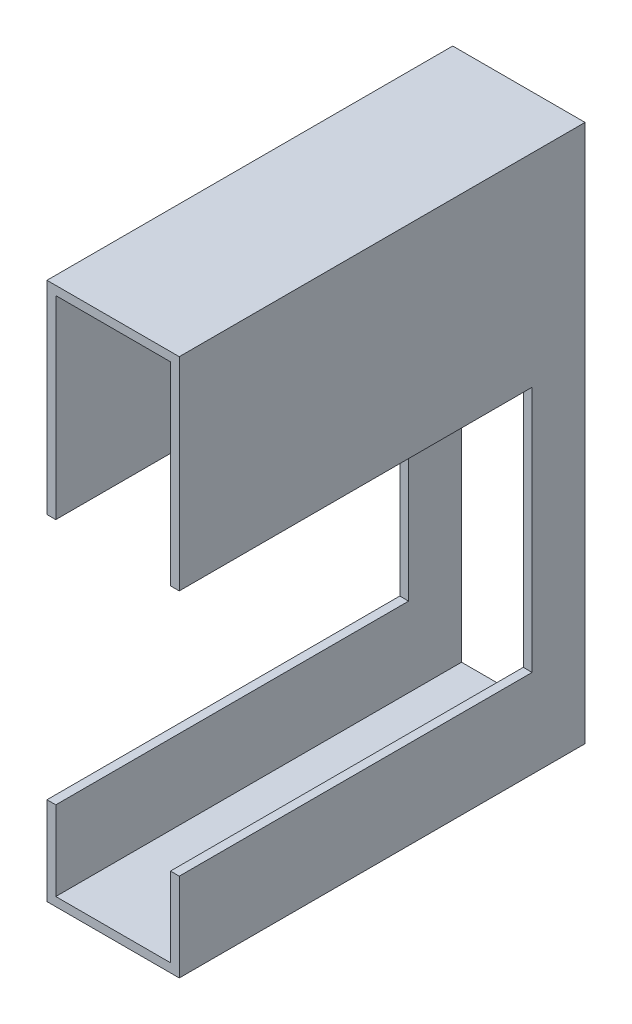
from build123d import *

# Parameters (mm, degrees)
SKETCH1_W           = 75
SKETCH1_H           = 305
SKETCH1_W_2         = 65
SKETCH1_H_2         = 295
BOSS_EXTRUDE1_DEPTH = 230
SKETCH2_W           = 200
SKETCH2_H           = 140
CUT_EXTRUDE1_DEPTH  = 286.974212124


with BuildPart() as part:
    # Sketch1 → Boss-Extrude1 (new body)
    with BuildSketch(Plane.XY):
        Rectangle(SKETCH1_W, SKETCH1_H)
        Rectangle(SKETCH1_W_2, SKETCH1_H_2, mode=Mode.SUBTRACT)
    extrude(amount=BOSS_EXTRUDE1_DEPTH)

    # Sketch2 → Cut-Extrude1 (cut, through all)
    with BuildSketch(Plane(origin=(37.5, 0, 0), x_dir=(0, 0, -1), z_dir=(1, 0, 0))):
        with Locations((-130, -32.5)):
            Rectangle(SKETCH2_W, SKETCH2_H)
    extrude(amount=-CUT_EXTRUDE1_DEPTH, mode=Mode.SUBTRACT)


solid = part.part
